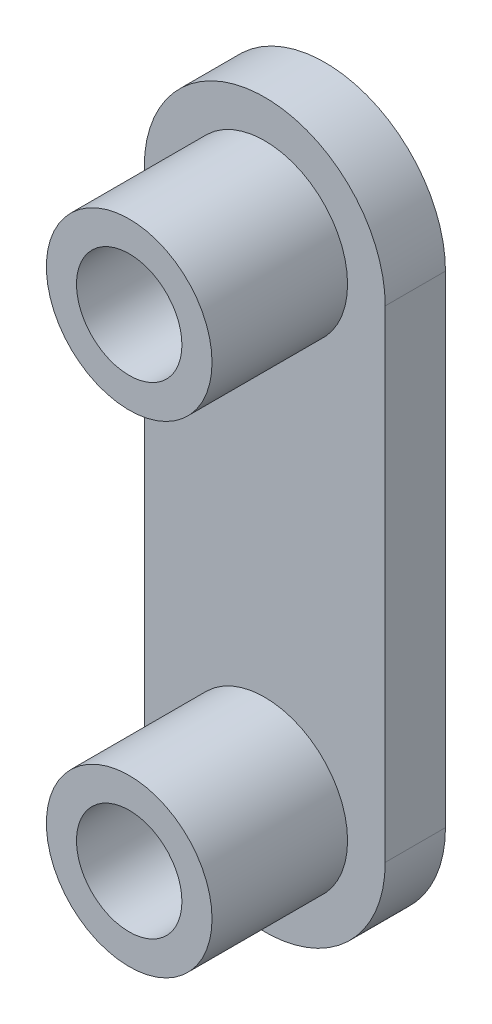
from build123d import *

# Parameters (mm, degrees)
BOSS_EXTRUDE1_DEPTH = 2
SKETCH1_3_R         = 2.75
SKETCH1_3_R_2       = 1.75
BOSS_EXTRUDE2_DEPTH = 4.5


with BuildPart() as part:
    # Sketch1 → Boss-Extrude1 (new body)
    with BuildSketch(Plane.XY):
        with BuildLine():
            ThreePointArc((4, 0), (0, 4), (-4, 0))
            Line((-4, 0), (-4, -16))
            ThreePointArc((-4, -16), (0, -20), (4, -16))
            Line((4, -16), (4, 0))
        make_face()
    extrude(amount=-BOSS_EXTRUDE1_DEPTH)

    # Sketch1<3> → Boss-Extrude2 (add)
    # profile 1 of 2: a face of its own
    with BuildSketch(Plane.XY):
        Circle(SKETCH1_3_R)
        Circle(SKETCH1_3_R_2, mode=Mode.SUBTRACT)
    # profile 2 of 2: a face of its own
    with BuildSketch(Plane.XY):
        with Locations((0, -16)):
            Circle(SKETCH1_3_R)
        with Locations((0, -16)):
            Circle(SKETCH1_3_R_2, mode=Mode.SUBTRACT)
    extrude(amount=BOSS_EXTRUDE2_DEPTH)


solid = part.part
